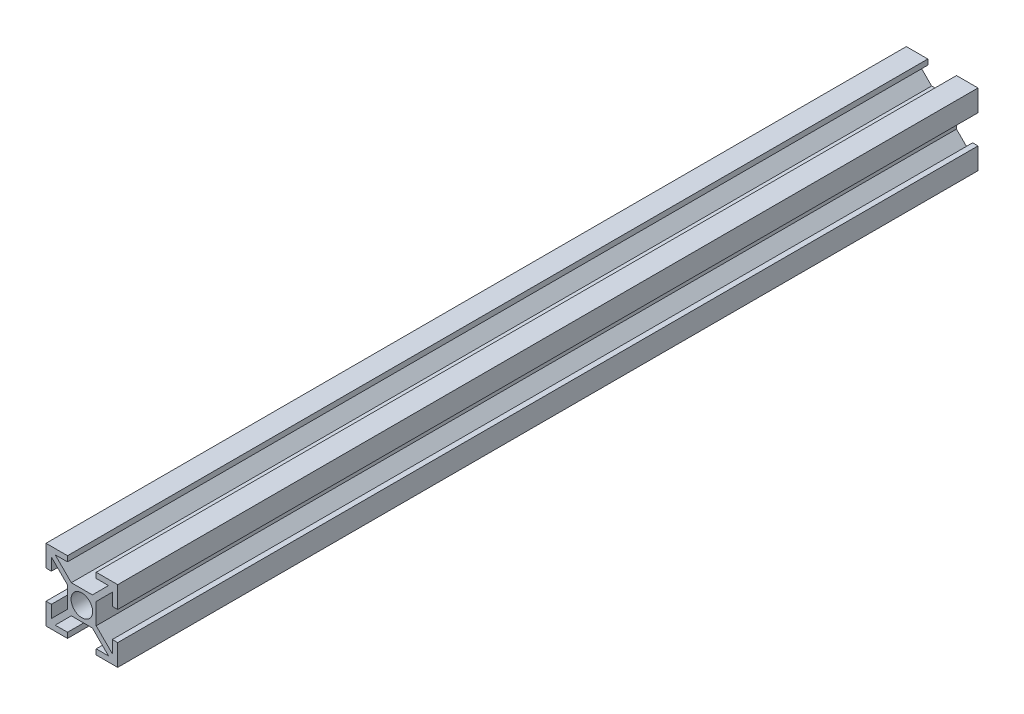
from build123d import *

# Parameters (mm, degrees)
ESBO_O1_R                = 3
RESSALTO_EXTRUS_O1_DEPTH = 240


with BuildPart() as part:
    # Esboço1 → Ressalto-extrusão1 (new body)
    with BuildSketch(Plane.XY):
        Polygon((-2.939339828, 4), (2.939339828, 4), (7.439339828, 8.5), (4, 8.5), (4, 10), (10, 10), (10, 4), (8.5, 4), (8.5, 7.439339828), (4, 2.939339828), (4, -2.939339828), (8.5, -7.439339828), (8.5, -4), (10, -4), (10, -10), (4, -10), (4, -8.5), (7.439339828, -8.5), (2.939339828, -4), (-2.939339828, -4), (-7.439339828, -8.5), (-4, -8.5), (-4, -10), (-10, -10), (-10, -4), (-8.5, -4), (-8.5, -7.439339828), (-4, -2.939339828), (-4, 2.939339828), (-8.5, 7.439339828), (-8.5, 4), (-10, 4), (-10, 10), (-4, 10), (-4, 8.5), (-7.439339828, 8.5), align=None)
        Circle(ESBO_O1_R, mode=Mode.SUBTRACT)
    extrude(amount=RESSALTO_EXTRUS_O1_DEPTH)


solid = part.part
